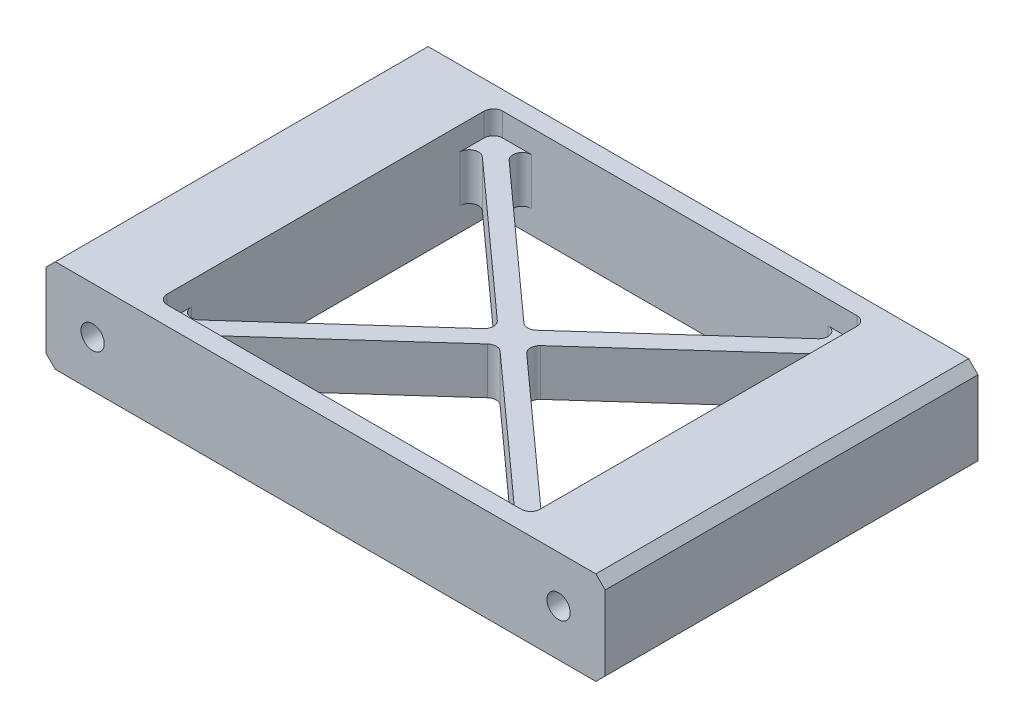
from build123d import *

# Parameters (mm, degrees)
EXTRUDE_428_DEPTH      = 5
EXTRUDE_428_DEPTH_BACK = 5
SKETCH_1_W             = 60
SKETCH_1_H             = 40
SKETCH_5_R             = 1.25
CUT_EXTRUDE_682_DEPTH  = 51.249378106
CUT_EXTRUDE_1222_DEPTH = 38.416573868
SKETCH_7_W             = 40
SKETCH_7_H             = 36
CUT_EXTRUDE_1460_DEPTH = 2.5
FILLET_1_R             = 1
FILLET_2_R             = 1
CHAMFER_1_SIZE         = 1


with BuildPart() as part:
    # Эскиз1 → Extrude 428 (new, two sides: drawn at the far end of the back side and taken through both)
    with BuildSketch(Plane(origin=(0, 0, 0), x_dir=(1, 0, 0), z_dir=(0, 1, 0)).offset(-EXTRUDE_428_DEPTH_BACK)):
        Rectangle(SKETCH_1_W, SKETCH_1_H)
    extrude(amount=EXTRUDE_428_DEPTH + EXTRUDE_428_DEPTH_BACK)

    # Эскиз5 → Cut-Extrude 682 (cut, through all)
    with BuildSketch(Plane.XY.offset(20)):
        with Locations((-25, 0)):
            Circle(SKETCH_5_R)
        with Locations((25, 0)):
            Circle(SKETCH_5_R)
    extrude(amount=-CUT_EXTRUDE_682_DEPTH, mode=Mode.SUBTRACT)

    # Эскиз6 → Cut-Extrude 1222 (cut, through all)
    with BuildSketch(Plane(origin=(0, 5, 0), x_dir=(1, 0, 0), z_dir=(0, 1, 0))):
        Polygon((-18.505152884, 18), (18.505152884, 18), (0, 1.345362405), align=None)
        Polygon((20, 16.654637595), (20, -16.654637595), (1.494847116, 0), align=None)
        Polygon((-18.505152884, -18), (18.505152884, -18), (0, -1.345362405), align=None)
        Polygon((-20, 16.654637595), (-20, -16.654637595), (-1.494847116, 0), align=None)
    extrude(amount=-CUT_EXTRUDE_1222_DEPTH, mode=Mode.SUBTRACT)

    # Эскиз7 → Cut-Extrude 1460 (cut)
    with BuildSketch(Plane(origin=(0, 5, 0), x_dir=(1, 0, 0), z_dir=(0, 1, 0))):
        Rectangle(SKETCH_7_W, SKETCH_7_H)
    cut_extrude_1460 = extrude(amount=-CUT_EXTRUDE_1460_DEPTH, mode=Mode.SUBTRACT)

    # Зеркальное отражение1: Cut-Extrude 1460 across plane
    add(cut_extrude_1460.mirror(Plane.ZX), mode=Mode.SUBTRACT)

    # Скругление1
    fillet_1_edges = [part.edges().sort_by_distance(p)[0] for p in [
        (-20, -3.75, -18),
        (-20, 3.75, -18),
        (-18.505152884, 0, -18),
        (-20, 0, -16.654637595),
        (20, -3.75, 18),
        (18.505152884, 0, 18),
        (20, 0, 16.654637595),
        (20, 3.75, 18),
        (-20, -3.75, 18),
        (-18.505152884, 0, 18),
        (-20, 0, 16.654637595),
        (-20, 3.75, 18),
        (20, -3.75, -18),
        (20, 0, -16.654637595),
        (18.505152884, 0, -18),
        (20, 3.75, -18),
    ]]
    fillet(fillet_1_edges, radius=FILLET_1_R)

    # Скругление2
    fillet_2_edges = [part.edges().sort_by_distance(p)[0] for p in [
        (-1.494847116, 0, 0),
        (0, 0, -1.345362405),
        (1.494847116, 0, 0),
        (0, 0, 1.345362405),
    ]]
    fillet(fillet_2_edges, radius=FILLET_2_R)

    # Фаска1
    chamfer_1_edges = [part.edges().sort_by_distance(p)[0] for p in [
        (-30, 5, 0),
        (-30, -5, 0),
        (30, -5, 0),
        (30, 5, 0),
    ]]
    chamfer(chamfer_1_edges, length=CHAMFER_1_SIZE)


solid = part.part
